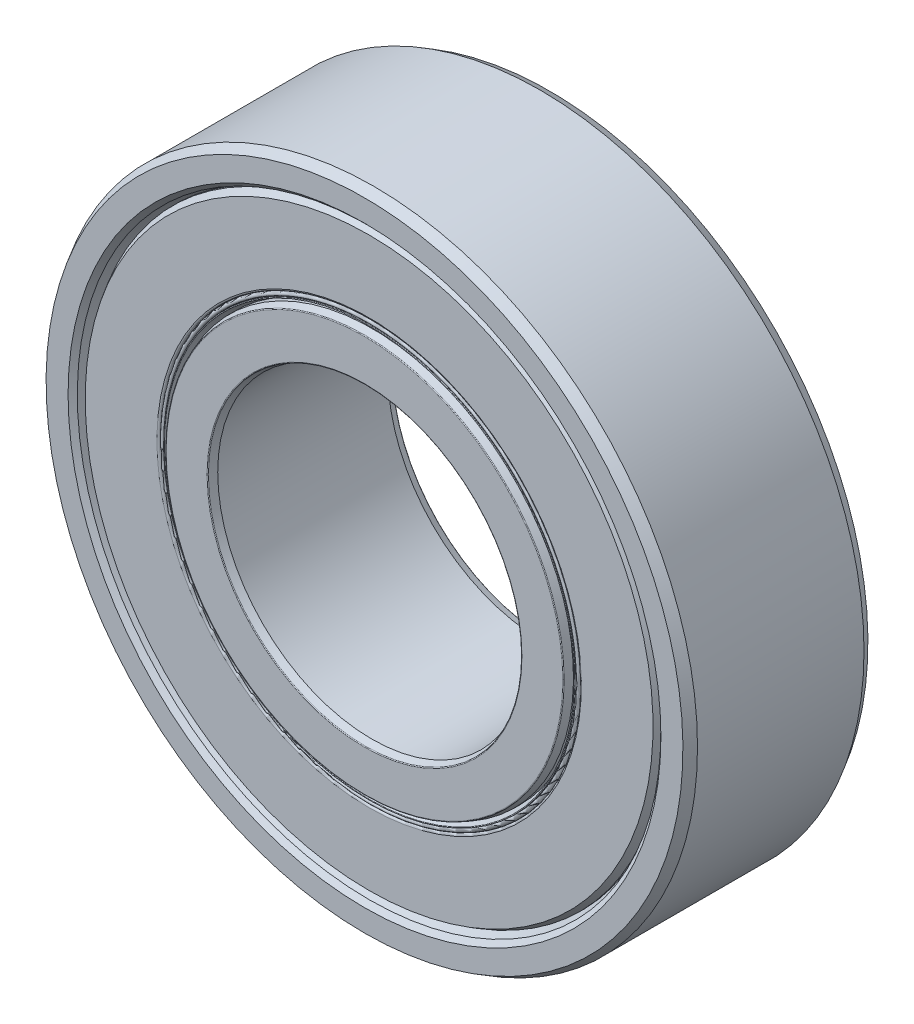
from build123d import *

# Parameters (mm, degrees)
CIRPATTERN1_COUNT = 9


with BuildPart() as part:
    # Sketch3 → Revolve1 (revolve)
    with BuildSketch(Plane(origin=(0, 0, 0), x_dir=(0, 0, -1), z_dir=(1, 0, 0)), mode=Mode.PRIVATE) as revolve1_sk:
        with BuildLine():
            Line((-5.048961855, 18.69), (-5.7, 18.926958506))
            Line((-5.7, 18.926958506), (-6, 19.226958506))
            Line((-6, 19.226958506), (-6, 20.653589838))
            Line((-6, 20.653589838), (-5.4, 21))
            Line((-5.4, 21), (5.4, 21))
            Line((5.4, 21), (6, 20.653589838))
            Line((6, 20.653589838), (6, 19.226958506))
            Line((6, 19.226958506), (5.7, 18.926958506))
            Line((5.7, 18.926958506), (5.048961855, 18.69))
            Line((5.048961855, 18.69), (2.796, 18.69))
            ThreePointArc((2.796, 18.69), (0, 19.845), (-2.796, 18.69))
            Line((-2.796, 18.69), (-5.048961855, 18.69))
        make_face()
    revolve(revolve1_sk.sketch.rotate(Axis((0, 0, 6), (0, 0, -1)), 180), axis=Axis((0, 0, 6), (0, 0, -1)))


with BuildPart() as body_2:
    # Sketch4 → Revolve2 (revolve)
    with BuildSketch(Plane(origin=(0, 0, 0), x_dir=(0, 0, -1), z_dir=(1, 0, 0)), mode=Mode.PRIVATE) as revolve2_sk:
        with BuildLine():
            Line((-5.52, 10), (-5.960521209, 10.160336607))
            ThreePointArc((-5.960521209, 10.160336607), (-5.989149123, 10.182303579), (-6, 10.216718165))
            Line((-6, 10.216718165), (-6, 12.859783134))
            ThreePointArc((-6, 12.859783134), (-5.989149123, 12.89419772), (-5.960521209, 12.916164691))
            Line((-5.960521209, 12.916164691), (-5.52, 13.076501299))
            Line((-5.52, 13.076501299), (-2.796, 13.076501299))
            ThreePointArc((-2.796, 13.076501299), (0, 11.921501299), (2.796, 13.076501299))
            Line((2.796, 13.076501299), (5.52, 13.076501299))
            Line((5.52, 13.076501299), (5.960521209, 12.916164691))
            ThreePointArc((5.960521209, 12.916164691), (5.989149123, 12.89419772), (6, 12.859783134))
            Line((6, 12.859783134), (6, 10.216718165))
            ThreePointArc((6, 10.216718165), (5.989149123, 10.182303579), (5.960521209, 10.160336607))
            Line((5.960521209, 10.160336607), (5.52, 10))
            Line((5.52, 10), (-5.52, 10))
        make_face()
    revolve(revolve2_sk.sketch.rotate(Axis((0, 0, 6), (0, 0, -1)), 180), axis=Axis((0, 0, 6), (0, 0, -1)))


with BuildPart() as body_3:
    # Sketch5 → Revolve3 (revolve)
    with BuildSketch(Plane(origin=(0, 0, 0), x_dir=(0, 0, -1), z_dir=(1, 0, 0))):
        with BuildLine():
            Line((-3.961749351, 15.883250649), (3.961749351, 15.883250649))
            ThreePointArc((3.961749351, 15.883250649), (0, 19.845), (-3.961749351, 15.883250649))
        make_face()
    revolve(axis=Axis((0, 15.883250649, 3.961749351), (0, 0, -1)))


with BuildPart() as cirpattern1_1:
    # CirPattern1: pattern copy
    add(body_3.part.rotate(Axis((0, 0, 0), (0, 0, 1)), 1 * 360 / CIRPATTERN1_COUNT))


with BuildPart() as cirpattern1_2:
    # CirPattern1: pattern copy
    add(body_3.part.rotate(Axis((0, 0, 0), (0, 0, 1)), 2 * 360 / CIRPATTERN1_COUNT))


with BuildPart() as cirpattern1_3:
    # CirPattern1: pattern copy
    add(body_3.part.rotate(Axis((0, 0, 0), (0, 0, 1)), 3 * 360 / CIRPATTERN1_COUNT))


with BuildPart() as cirpattern1_4:
    # CirPattern1: pattern copy
    add(body_3.part.rotate(Axis((0, 0, 0), (0, 0, 1)), 4 * 360 / CIRPATTERN1_COUNT))


with BuildPart() as cirpattern1_5:
    # CirPattern1: pattern copy
    add(body_3.part.rotate(Axis((0, 0, 0), (0, 0, 1)), 5 * 360 / CIRPATTERN1_COUNT))


with BuildPart() as cirpattern1_6:
    # CirPattern1: pattern copy
    add(body_3.part.rotate(Axis((0, 0, 0), (0, 0, 1)), 6 * 360 / CIRPATTERN1_COUNT))


with BuildPart() as cirpattern1_7:
    # CirPattern1: pattern copy
    add(body_3.part.rotate(Axis((0, 0, 0), (0, 0, 1)), 7 * 360 / CIRPATTERN1_COUNT))


with BuildPart() as cirpattern1_8:
    # CirPattern1: pattern copy
    add(body_3.part.rotate(Axis((0, 0, 0), (0, 0, 1)), 8 * 360 / CIRPATTERN1_COUNT))


with BuildPart() as body_12:
    # Sketch6 → Revolve4 (revolve)
    with BuildSketch(Plane(origin=(0, 0, 0), x_dir=(0, 0, -1), z_dir=(1, 0, 0)), mode=Mode.PRIVATE) as revolve4_sk:
        with BuildLine():
            Line((-5.223686028, 18.69), (-3.961749351, 18.69))
            Line((-3.961749351, 18.69), (-3.961749351, 13.626501299))
            Line((-3.961749351, 13.626501299), (-5.5625, 13.626501299))
            ThreePointArc((-5.5625, 13.626501299), (-5.659727182, 13.666774116), (-5.7, 13.764001299))
            Line((-5.7, 13.764001299), (-5.7, 18.415))
            Line((-5.7, 18.415), (-5.223686028, 18.69))
        make_face()
        with BuildLine():
            Line((5.5625, 13.626501299), (3.961749351, 13.626501299))
            Line((3.961749351, 13.626501299), (3.961749351, 18.69))
            Line((3.961749351, 18.69), (5.223686028, 18.69))
            Line((5.223686028, 18.69), (5.7, 18.415))
            Line((5.7, 18.415), (5.7, 13.764001299))
            ThreePointArc((5.7, 13.764001299), (5.659727182, 13.666774116), (5.5625, 13.626501299))
        make_face()
    revolve(revolve4_sk.sketch.rotate(Axis((0, 0, 6), (0, 0, -1)), 180), axis=Axis((0, 0, 6), (0, 0, -1)))


with BuildPart() as body_13:
    # Sketch7 → Revolve5 (revolve)
    with BuildSketch(Plane(origin=(0, 0, 0), x_dir=(0, 0, -1), z_dir=(1, 0, 0)), mode=Mode.PRIVATE) as revolve5_sk:
        with BuildLine():
            Line((-3.961749351, 13.076501299), (-5.084582164, 13.076501299))
            Line((-5.084582164, 13.076501299), (-5.680260604, 13.29331052))
            ThreePointArc((-5.680260604, 13.29331052), (-5.699544233, 13.326710744), (-5.67, 13.351501299))
            Line((-5.67, 13.351501299), (-5.5625, 13.351501299))
            ThreePointArc((-5.5625, 13.351501299), (-5.7, 13.489001299), (-5.5625, 13.626501299))
            Line((-5.5625, 13.626501299), (-3.961749351, 13.626501299))
            Line((-3.961749351, 13.626501299), (-3.961749351, 13.076501299))
        make_face()
        with BuildLine():
            Line((3.961749351, 13.626501299), (3.961749351, 13.076501299))
            Line((3.961749351, 13.076501299), (5.084582164, 13.076501299))
            Line((5.084582164, 13.076501299), (5.680260604, 13.29331052))
            ThreePointArc((5.680260604, 13.29331052), (5.699544233, 13.326710744), (5.67, 13.351501299))
            Line((5.67, 13.351501299), (5.5625, 13.351501299))
            ThreePointArc((5.5625, 13.351501299), (5.7, 13.489001299), (5.5625, 13.626501299))
            Line((5.5625, 13.626501299), (3.961749351, 13.626501299))
        make_face()
    revolve(revolve5_sk.sketch.rotate(Axis((0, 0, 6), (0, 0, -1)), 180), axis=Axis((0, 0, 6), (0, 0, -1)))


solid = Compound([part.part, body_2.part, body_3.part, cirpattern1_1.part, cirpattern1_2.part, cirpattern1_3.part, cirpattern1_4.part, cirpattern1_5.part, cirpattern1_6.part, cirpattern1_7.part, cirpattern1_8.part, body_12.part, body_13.part])
